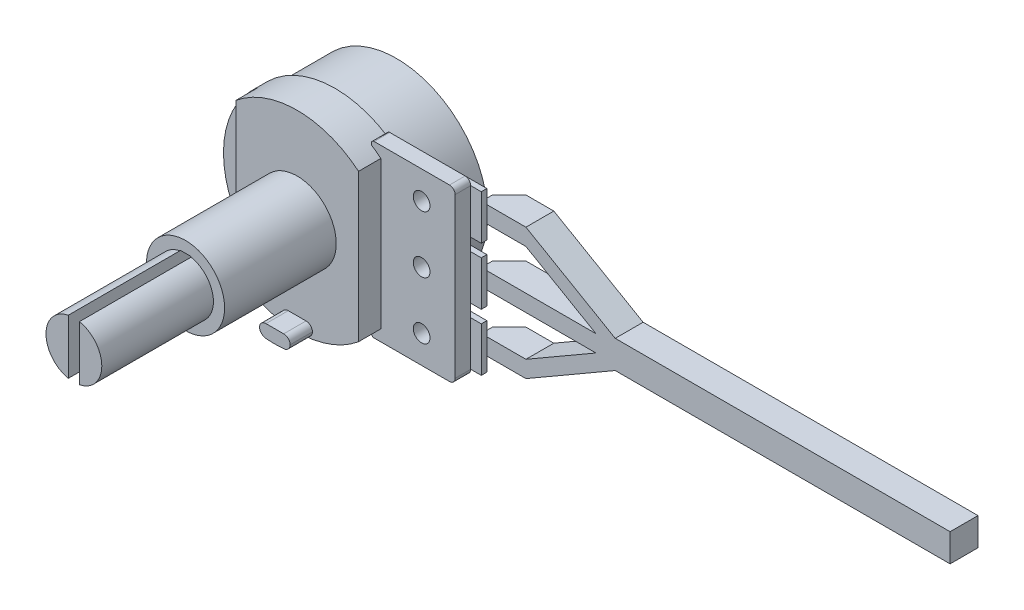
from build123d import *
from build123d.topology import SkipClean

# Parameters (mm, degrees)
SKETCH_2_R          = 8.175
EXTRUDE_1_DEPTH     = 5.5
EXTRUDE_2_DEPTH     = 1.4
SKETCH_5_W          = 2.5
SKETCH_5_H          = 2.5
CUT_EXTRUDE_1_DEPTH = 2.5
EXTRUDE_3_DEPTH     = 2
SKETCH_7_R          = 3.5
EXTRUDE_4_DEPTH     = 10
SKETCH_8_R          = 2.5
EXTRUDE_5_DEPTH     = 10
SKETCH_9_W          = 1
SKETCH_9_H          = 5
CUT_EXTRUDE_5_DEPTH = 11.5
EXTRUDE_START       = 0.5
EXTRUDE_6_DEPTH     = 0.5
SKETCH_14_W         = 3.5
SKETCH_14_H         = 1.5
SKETCH_14_W_2       = 0.5
SKETCH_14_W_3       = 4
EXTRUDE_7_DEPTH     = 2.5
SKETCH_11_R         = 0.75
CUT_EXTRUDE_6_DEPTH = 1.9
CHAMFER_1_SIZE      = 1.5
EXTRUDE_4636_DEPTH  = 2


with BuildPart() as part:
    # Эскиз2 → Бобышка-Вытянуть1 (new body)
    with BuildSketch(Plane.XY):
        Circle(SKETCH_2_R)
    extrude(amount=EXTRUDE_1_DEPTH)

    # Эскиз3 → Бобышка-Вытянуть2 (add)
    with BuildSketch(Plane.XY.offset(5.5)):
        with BuildLine():
            Line((4.65, -7.375), (4.65, -7.234466117))
            ThreePointArc((4.65, -7.234466117), (-8.6, 0), (4.65, 7.234466117))
            Line((4.65, 7.234466117), (4.65, 7.375))
            ThreePointArc((4.65, 7.375), (4.723223305, 7.551776695), (4.9, 7.625))
            Line((4.9, 7.625), (11.65, 7.625))
            ThreePointArc((11.65, 7.625), (12.003553391, 7.478553391), (12.15, 7.125))
            Line((12.15, 7.125), (12.15, -7.125))
            ThreePointArc((12.15, -7.125), (12.003553391, -7.478553391), (11.65, -7.625))
            Line((11.65, -7.625), (4.9, -7.625))
            ThreePointArc((4.9, -7.625), (4.723223305, -7.551776695), (4.65, -7.375))
        make_face()
    extrude(amount=EXTRUDE_2_DEPTH)

    # Эскиз5 → Вырез-Вытянуть1 (cut)
    with BuildSketch(Plane(origin=(0, 0, 0), x_dir=(-1, 0, 0), z_dir=(0, 0, -1))):
        with Locations((0, -6.925)):
            Rectangle(SKETCH_5_W, SKETCH_5_H)
    extrude(amount=-CUT_EXTRUDE_1_DEPTH, mode=Mode.SUBTRACT)

    # Эскиз6 → Бобышка-Вытянуть3 (add)
    with SkipClean():  # the faces are left unmerged after this step: merging them gives an invalid solid
        with BuildSketch(Plane.XY.offset(6.9)):
            with BuildLine():
                Line((-5.5, 6.61135387), (-5.5, -6.61135387))
                ThreePointArc((-5.5, -6.61135387), (0, -8.6), (5.5, -6.61135387))
                Line((5.5, -6.61135387), (5.5, 6.61135387))
                ThreePointArc((5.5, 6.61135387), (0, 8.6), (-5.5, 6.61135387))
            make_face()
        extrude(amount=EXTRUDE_3_DEPTH)

    # Эскиз7 → Бобышка-Вытянуть4 (add)
    with SkipClean():  # the faces are left unmerged after this step: merging them gives an invalid solid
        with BuildSketch(Plane.XY.offset(8.9)):
            Circle(SKETCH_7_R)
        extrude(amount=EXTRUDE_4_DEPTH)

    # Эскиз8 → Бобышка-Вытянуть5 (add)
    with SkipClean():  # the faces are left unmerged after this step: merging them gives an invalid solid
        with BuildSketch(Plane.XY.offset(18.9)):
            Circle(SKETCH_8_R)
        extrude(amount=EXTRUDE_5_DEPTH)

    # Эскиз9 → Вырез-Вытянуть5 (cut)
    with SkipClean():  # the faces are left unmerged after this step: merging them gives an invalid solid
        with BuildSketch(Plane.XY.offset(28.9)):
            Rectangle(SKETCH_9_W, SKETCH_9_H)
        extrude(amount=-CUT_EXTRUDE_5_DEPTH, mode=Mode.SUBTRACT)

    # Эскиз12 → Бобышка-Вытянуть6 (add)
    with SkipClean():  # the faces are left unmerged after this step: merging them gives an invalid solid
        with BuildSketch(Plane(origin=(0, 0, 5.5), x_dir=(-1, 0, 0), z_dir=(0, 0, -1)).offset(EXTRUDE_START)):
            with BuildLine():
                Line((-9.15, -2), (-13.095809491, -2))
                Line((-13.095809491, -2), (-13.095809491, 2))
                Line((-13.095809491, 2), (-9.15, 2))
                ThreePointArc((-9.15, 2), (-8.551799079, 1.908443255), (-8.008367486, 1.642155658))
                ThreePointArc((-8.008367486, 1.642155658), (-8.175, 0), (-8.008367486, -1.642155658))
                ThreePointArc((-8.008367486, -1.642155658), (-8.551799079, -1.908443255), (-9.15, -2))
            make_face()
            with BuildLine():
                Line((-9.15, 7.125860343), (-13.095809491, 7.125860343))
                Line((-13.095809491, 7.125860343), (-13.095809491, 3.125860343))
                Line((-13.095809491, 3.125860343), (-9.15, 3.125860343))
                ThreePointArc((-9.15, 3.125860343), (-7.15, 5.125860343), (-9.15, 7.125860343))
            make_face()
            with BuildLine():
                Line((-13.095809491, -3.125), (-13.095809491, -7.125))
                Line((-13.095809491, -7.125), (-9.15, -7.125))
                ThreePointArc((-9.15, -7.125), (-7.15, -5.125), (-9.15, -3.125))
                Line((-9.15, -3.125), (-13.095809491, -3.125))
            make_face()
        extrude(amount=-EXTRUDE_6_DEPTH)

    # Эскиз11 → Вырез-Вытянуть6 (cut)
    with SkipClean():  # the faces are left unmerged after this step: merging them gives an invalid solid
        with BuildSketch(Plane.XY.offset(6.9)):
            with Locations((9.15, 5.125)):
                Circle(SKETCH_11_R)
            with Locations((9.15, 0)):
                Circle(SKETCH_11_R)
            with Locations((9.15, -5.125)):
                Circle(SKETCH_11_R)
        extrude(amount=-CUT_EXTRUDE_6_DEPTH, mode=Mode.SUBTRACT)

    # Sketch 4220 → Extrude 4636 (add)
    with SkipClean():  # the faces are left unmerged after this step: merging them gives an invalid solid
        with BuildSketch(Plane.XY.offset(8.9)):
            with BuildLine():
                Line((0.795, -7.35), (-0.795, -7.35))
                ThreePointArc((-0.795, -7.35), (-1.197101063, -7.512011083), (-1.374564786, -7.907535396))
                ThreePointArc((-1.374564786, -7.907535396), (-1.20593337, -8.309819178), (-0.814100732, -8.501485504))
                ThreePointArc((-0.814100732, -8.501485504), (0, -8.540375622), (0.814100732, -8.501485504))
                ThreePointArc((0.814100732, -8.501485504), (1.20593337, -8.309819178), (1.374564786, -7.907535396))
                ThreePointArc((1.374564786, -7.907535396), (1.197101063, -7.512011083), (0.795, -7.35))
            make_face()
        extrude(amount=EXTRUDE_4636_DEPTH)


with BuildPart() as body_2:
    # Эскиз14 → Бобышка-Вытянуть7 (new body)
    with BuildSketch(Plane(origin=(0, 0, 5), x_dir=(-1, 0, 0), z_dir=(0, 0, -1))):
        with Locations((-14.845809491, 5.125860343)):
            Rectangle(SKETCH_14_W, SKETCH_14_H)
        with Locations((-12.845809491, 5.125860343)):
            Rectangle(SKETCH_14_W_2, SKETCH_14_H)
        with Locations((-14.595809491, 0)):
            Rectangle(SKETCH_14_W_3, SKETCH_14_H)
        with Locations((-14.595809491, -5.125)):
            Rectangle(SKETCH_14_W_3, SKETCH_14_H)
        Polygon((-16.595809491, 4.375860343), (-16.595809491, 5.875860343), (-24.595809491, 1.250091519), (-26.757770569, 0), (-24.163607208, 0), (-22.866525527, 0.75), align=None)
        Polygon((-16.595809491, 0), (-24.163607208, 0), (-22.866270457, -0.75), (-16.595809491, -0.75), align=None)
        Polygon((-16.595809491, 0.75), (-22.866525527, 0.75), (-24.163607208, 0), (-16.595809491, 0), align=None)
        Polygon((-24.163607208, 0), (-26.757770569, 0), (-24.595809491, -1.249908481), (-16.595809491, -5.875), (-16.595809491, -4.375), (-22.866270457, -0.75), align=None)
        Polygon((-26.757770569, 0), (-24.595809491, 1.250091519), (-54.595809491, 1.250091519), (-54.595809491, -1.249908481), (-24.595809491, -1.249908481), align=None)
    extrude(amount=EXTRUDE_7_DEPTH)

    # Фаска1
    chamfer_1_edges = [body_2.edges().sort_by_distance(p)[0] for p in [
        (12.595809491, 0, 2.5),
        (12.595809491, 5.125860343, 2.5),
        (12.595809491, -5.125, 2.5),
    ]]
    chamfer(chamfer_1_edges, length=CHAMFER_1_SIZE)


solid = Compound([part.part, body_2.part])
